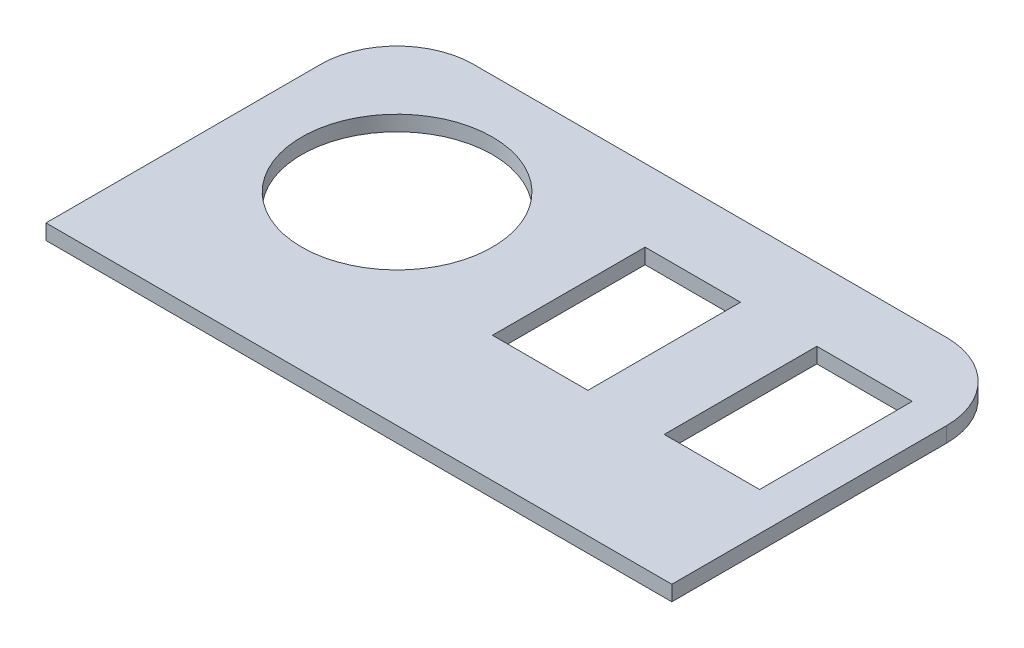
from build123d import *

# Parameters (mm, degrees)
SKETCH_1_W      = 82
SKETCH_1_H      = 46
SKETCH_1_R      = 12.5
SKETCH_1_W_2    = 12.5
SKETCH_1_H_2    = 20
EXTRUDE_1_DEPTH = 2
FILLET_1_R      = 10


with BuildPart() as part:
    # 草图1 → 凸台-拉伸1 (new body)
    with BuildSketch(Plane(origin=(0, 0, 0), x_dir=(1, 0, 0), z_dir=(0, 1, 0))):
        Rectangle(SKETCH_1_W, SKETCH_1_H)
        with Locations(Location((-21.5, 3.5, 0), (0, 0, 270))):
            Circle(SKETCH_1_R, mode=Mode.SUBTRACT)
        with Locations((7.25, 3.5)):
            Rectangle(SKETCH_1_W_2, SKETCH_1_H_2, mode=Mode.SUBTRACT)
        with Locations((29.75, 3.5)):
            Rectangle(SKETCH_1_W_2, SKETCH_1_H_2, mode=Mode.SUBTRACT)
    extrude(amount=EXTRUDE_1_DEPTH)

    # 圆角1
    fillet_1_edges = [part.edges().sort_by_distance(p)[0] for p in [
        (-41, 1, -23),
        (41, 1, -23),
    ]]
    fillet(fillet_1_edges, radius=FILLET_1_R)


solid = part.part
